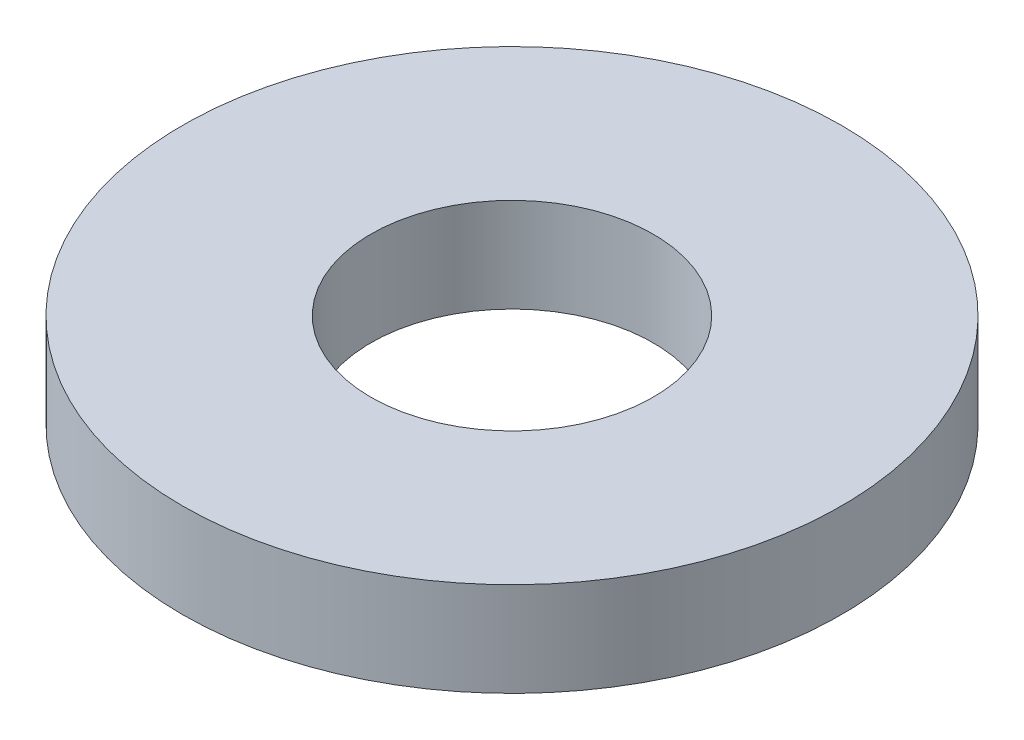
from build123d import *

# Parameters (mm, degrees)
SKETCH1_R           = 5.55625
SKETCH1_R_2         = 2.38125
BOSS_EXTRUDE1_DEPTH = 1.5875


with BuildPart() as part:
    # Sketch1 → Boss-Extrude1 (new body)
    with BuildSketch(Plane(origin=(0, 0, 0), x_dir=(1, 0, 0), z_dir=(0, 1, 0))):
        with Locations(Location((0, 0, 0), (0, 0, 270))):
            Circle(SKETCH1_R)
        with Locations(Location((0, 0, 0), (0, 0, 270))):
            Circle(SKETCH1_R_2, mode=Mode.SUBTRACT)
    extrude(amount=BOSS_EXTRUDE1_DEPTH)


solid = part.part
